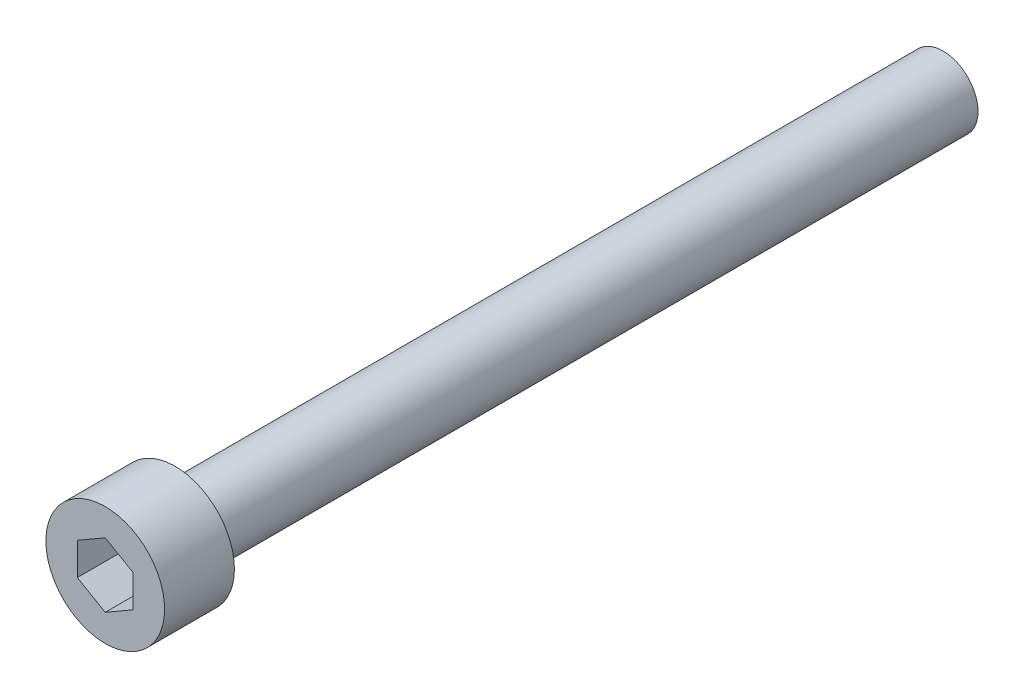
from build123d import *

# Parameters (mm, degrees)
SKETCH_1_R          = 2.5
EXTRUDE_1_DEPTH     = 55
SKETCH_2_R          = 4.25
EXTRUDE_2_DEPTH     = 5
CUT_EXTRUDE_1_DEPTH = 3


with BuildPart() as part:
    # ｽｹｯﾁ1 → ﾎﾞｽ - 押し出し1 (new body)
    with BuildSketch(Plane.XY):
        Circle(SKETCH_1_R)
    extrude(amount=EXTRUDE_1_DEPTH)

    # ｽｹｯﾁ2 → ﾎﾞｽ - 押し出し2 (add)
    with BuildSketch(Plane.XY.offset(55)):
        Circle(SKETCH_2_R)
    extrude(amount=EXTRUDE_2_DEPTH)

    # ｽｹｯﾁ3 → ｶｯﾄ - 押し出し1 (cut)
    with BuildSketch(Plane.XY.offset(60)):
        Polygon((0, 2.309401077), (-2, 1.154700538), (-2, -1.154700538), (0, -2.309401077), (2, -1.154700538), (2, 1.154700538), align=None)
    extrude(amount=-CUT_EXTRUDE_1_DEPTH, mode=Mode.SUBTRACT)


solid = part.part
